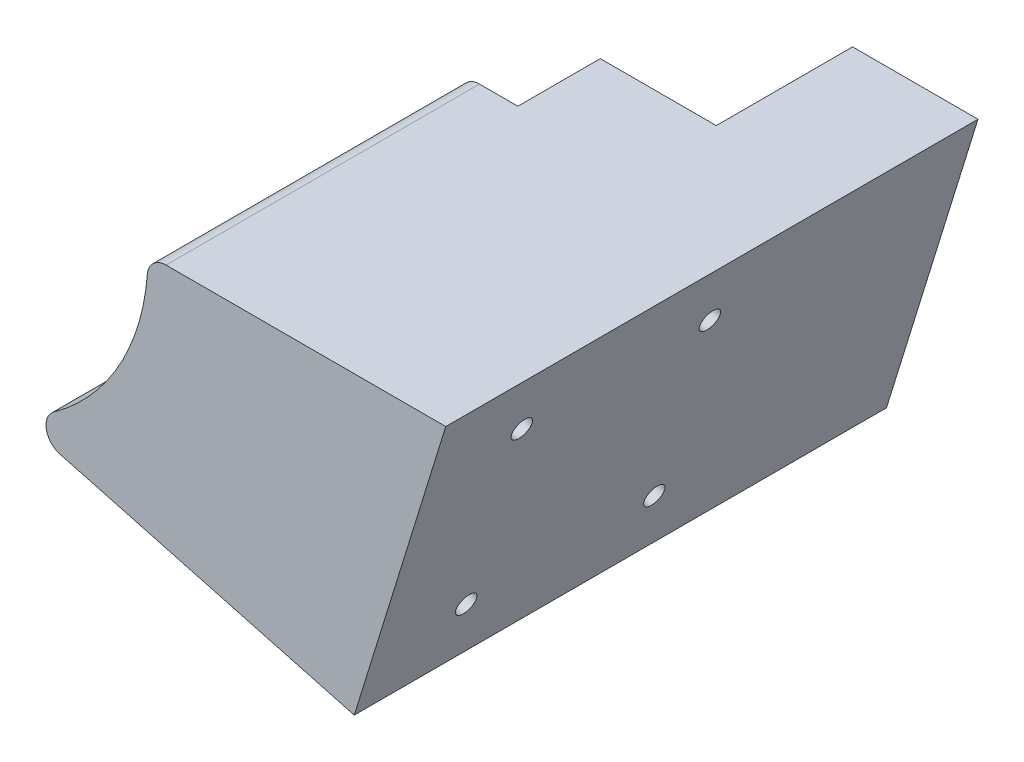
from build123d import *

# Parameters (mm, degrees)
BOSS_EXTRUDE1_DEPTH             = 50
BOSS_EXTRUDE2_START             = 13.15
BOSS_EXTRUDE2_DEPTH             = 13.15
BOSS_EXTRUDE3_DEPTH             = 21.75
BOSS_EXTRUDE3_DEPTH_BACK        = 63.15
CUT_EXTRUDE1_DEPTH              = 145.663436984
FILLET1_R                       = 3
CUT_EXTRUDE2_DEPTH              = 129.082637169
TAP_DRILL_FOR_M4X0_7_TAP1_D     = 3.3
TAP_DRILL_FOR_M4X0_7_TAP1_DEPTH = 10
TAP_DRILL_FOR_M4X0_7_TAP1_TIP   = 0.991420021


with BuildPart() as part:
    # Sketch1 → Boss-Extrude1 (new body)
    with BuildSketch(Plane.XY):
        with BuildLine():
            Line((36, 0), (63.5, 0))
            ThreePointArc((63.5, 0), (49.923691771, -39.241241061), (15, -61.702917273))
            Line((15, -61.702917273), (15, -32.726136344))
            ThreePointArc((15, -32.726136344), (30.298514815, -19.442222095), (36, 0))
        make_face()
    extrude(amount=BOSS_EXTRUDE1_DEPTH)

    # Sketch2 → Boss-Extrude2 (add)
    with BuildSketch(Plane(origin=(0, 0, 0), x_dir=(-1, 0, 0), z_dir=(0, 0, -1)).offset(BOSS_EXTRUDE2_START)):
        with BuildLine():
            Line((-45, 0), (-63.5, 0))
            ThreePointArc((-63.5, 0), (-49.923691771, -39.241241061), (-15, -61.702917273))
            Line((-15, -61.702917273), (-15, -42.426406871))
            ThreePointArc((-15, -42.426406871), (-36.742346142, -25.980762114), (-45, 0))
        make_face()
    extrude(amount=-BOSS_EXTRUDE2_DEPTH)

    # Sketch3 → Boss-Extrude3 (add, two sides: drawn at the far end of the back side and taken through both)
    with BuildSketch(Plane(origin=(0, 0, -13.15), x_dir=(-1, 0, 0), z_dir=(0, 0, -1)).offset(-BOSS_EXTRUDE3_DEPTH_BACK)):
        with BuildLine():
            Line((-63.5, 0), (-83.5, 0))
            ThreePointArc((-83.5, 0), (-64.127802083, -53.477799132), (-15, -82.141645954))
            Line((-15, -82.141645954), (-15, -61.702917273))
            ThreePointArc((-15, -61.702917273), (-49.923691771, -39.241241061), (-63.5, 0))
        make_face()
    extrude(amount=BOSS_EXTRUDE3_DEPTH + BOSS_EXTRUDE3_DEPTH_BACK)

    # Sketch4 → Cut-Extrude1 (cut, through all)
    with BuildSketch(Plane.XY.offset(50)):
        with BuildLine():
            Line((15, -32.726136344), (68.901001848, -47.16886626))
            ThreePointArc((68.901001848, -47.16886626), (45.449074332, -70.047352857), (15, -82.141645954))
            Line((15, -82.141645954), (15, -32.726136344))
        make_face()
    extrude(amount=-CUT_EXTRUDE1_DEPTH, mode=Mode.SUBTRACT)

    # Fillet1
    fillet1_edges = [part.edges().sort_by_distance(p)[0] for p in [
        (36, 0, 25),
        (15, -32.726136344, 25),
    ]]
    fillet(fillet1_edges, radius=FILLET1_R)

    # Sketch5 → Cut-Extrude2 (cut, through all)
    with BuildSketch(Plane.XY.offset(50)):
        with BuildLine():
            Line((83.5, 0), (68.901001848, -47.16886626))
            ThreePointArc((68.901001848, -47.16886626), (79.766796521, -24.688219313), (83.5, 0))
        make_face()
    extrude(amount=-CUT_EXTRUDE2_DEPTH, mode=Mode.SUBTRACT)

    # Tap Drill for M4x0.7 Tap1
    with Locations(Plane(origin=(76.200500924, -23.58443313, 0), x_dir=(0, 0, -1), z_dir=(0.9552909762953877, -0.29566729715781054, 0))):
        with Locations((-35, 15), (-35, -15), (-5, 15), (-5, -15)):
            Hole(TAP_DRILL_FOR_M4X0_7_TAP1_D / 2, depth=TAP_DRILL_FOR_M4X0_7_TAP1_DEPTH)
            with Locations((0, 0, -(TAP_DRILL_FOR_M4X0_7_TAP1_DEPTH + TAP_DRILL_FOR_M4X0_7_TAP1_TIP / 2))):  # 118° drill point
                Cone(0, TAP_DRILL_FOR_M4X0_7_TAP1_D / 2, TAP_DRILL_FOR_M4X0_7_TAP1_TIP, mode=Mode.SUBTRACT)


solid = part.part
